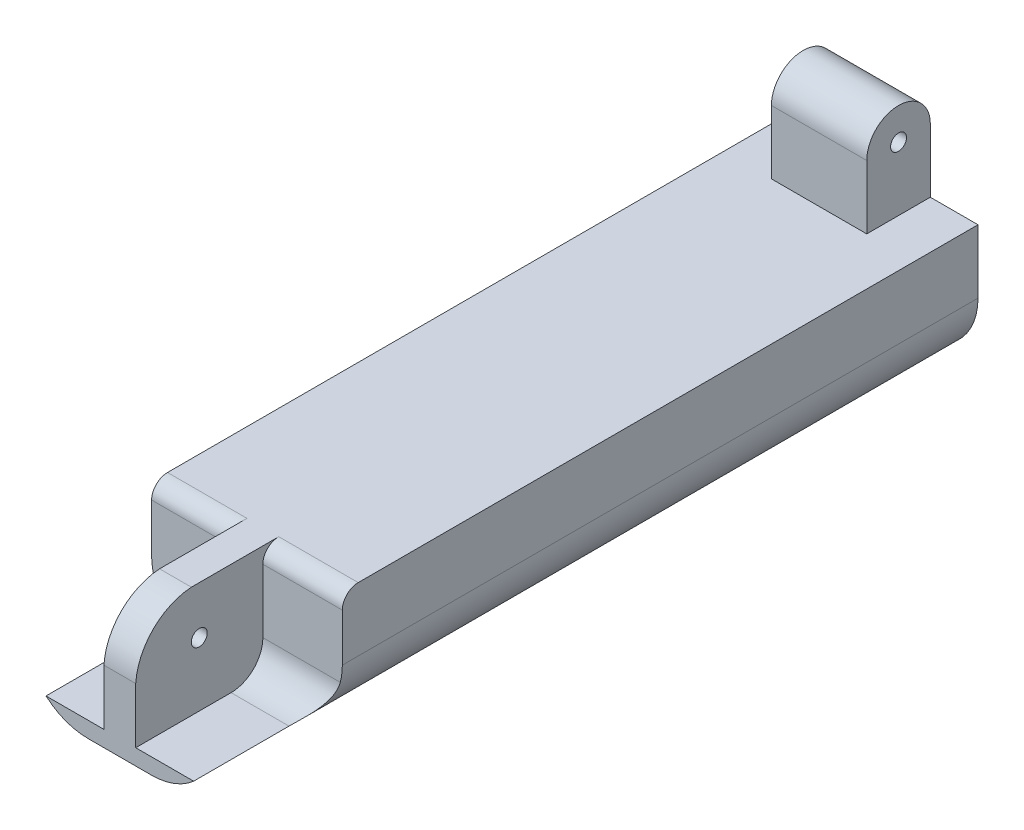
from build123d import *

# Parameters (mm, degrees)
SKETCH1_W           = 60
SKETCH1_H           = 40
BOSS_EXTRUDE1_DEPTH = 240
SKETCH2_W           = 25
SKETCH2_H           = 40
CUT_EXTRUDE1_DEPTH  = 35
BOSS_EXTRUDE7_DEPTH = 25
BOSS_EXTRUDE5_START = 25
BOSS_EXTRUDE5_DEPTH = 25
SKETCH3_W           = 30
SKETCH3_H           = 20
BOSS_EXTRUDE2_DEPTH = 35
SKETCH5_R           = 2.5
CUT_EXTRUDE3_DEPTH  = 30
CUT_EXTRUDE4_DEPTH  = 240
CUT_EXTRUDE5_DEPTH  = 20
CUT_EXTRUDE6_DEPTH  = 25
CUT_EXTRUDE7_START  = -25
CUT_EXTRUDE7_DEPTH  = 25
SKETCH19_R          = 2.5
CUT_EXTRUDE8_DEPTH  = 30
CUT_EXTRUDE9_DEPTH  = 30


with BuildPart() as part:
    # Sketch1 → Boss-Extrude1 (new body)
    with BuildSketch(Plane.XY):
        with Locations((-30, 20)):
            Rectangle(SKETCH1_W, SKETCH1_H)
    extrude(amount=BOSS_EXTRUDE1_DEPTH)

    # Sketch2 → Cut-Extrude1 (cut)
    with BuildSketch(Plane(origin=(0, 40, 0), x_dir=(1, 0, 0), z_dir=(0, 1, 0))):
        with Locations((-47.5, -220)):
            Rectangle(SKETCH2_W, SKETCH2_H)
        with Locations((-12.5, -220)):
            Rectangle(SKETCH2_W, SKETCH2_H)
    extrude(amount=-CUT_EXTRUDE1_DEPTH, mode=Mode.SUBTRACT)

    # Sketch18 → Boss-Extrude7 (add)
    with BuildSketch(Plane(origin=(-25, 0, 0), x_dir=(0, 0, -1), z_dir=(1, 0, 0))):
        with BuildLine():
            Line((-200, 5), (-210, 5))
            ThreePointArc((-210, 5), (-202.928932188, 7.928932188), (-200, 15))
            Line((-200, 15), (-200, 5))
        make_face()
    extrude(amount=BOSS_EXTRUDE7_DEPTH)

    # Sketch16 → Boss-Extrude5 (add)
    with BuildSketch(Plane.ZY.offset(35).offset(BOSS_EXTRUDE5_START)):
        with BuildLine():
            Line((200, 15), (160, 5))
            Line((160, 5), (210, 5))
            ThreePointArc((210, 5), (202.928932188, 7.928932188), (200, 15))
        make_face()
    extrude(amount=-BOSS_EXTRUDE5_DEPTH)

    # Sketch3 → Boss-Extrude2 (add)
    with BuildSketch(Plane(origin=(0, 40, 0), x_dir=(1, 0, 0), z_dir=(0, 1, 0))):
        with Locations((-30, -10)):
            Rectangle(SKETCH3_W, SKETCH3_H)
    extrude(amount=BOSS_EXTRUDE2_DEPTH)

    # Sketch5 → Cut-Extrude3 (cut)
    with BuildSketch(Plane(origin=(-25, 0, 0), x_dir=(0, 0, -1), z_dir=(1, 0, 0))):
        with Locations((-220, 25)):
            Circle(SKETCH5_R)
    extrude(amount=-CUT_EXTRUDE3_DEPTH, mode=Mode.SUBTRACT)

    # Sketch6 → Cut-Extrude4 (cut)
    with BuildSketch(Plane(origin=(0, 0, 0), x_dir=(-1, 0, 0), z_dir=(0, 0, -1))):
        with BuildLine():
            Line((60, 20), (60, 0))
            Line((60, 0), (40, 0))
            ThreePointArc((40, 0), (54.142135624, 5.857864376), (60, 20))
        make_face()
        with BuildLine():
            Line((0, 20), (0, 0))
            Line((0, 0), (20, 0))
            ThreePointArc((20, 0), (5.857864376, 5.857864376), (0, 20))
        make_face()
    extrude(amount=-CUT_EXTRUDE4_DEPTH, mode=Mode.SUBTRACT)

    # Sketch8 → Cut-Extrude5 (cut)
    with BuildSketch(Plane(origin=(-25, 0, 0), x_dir=(0, 0, -1), z_dir=(1, 0, 0))):
        with BuildLine():
            Line((-240, 40), (-240, 22.5))
            ThreePointArc((-240, 22.5), (-234.537682266, 34.537682266), (-222.5, 40))
            Line((-222.5, 40), (-240, 40))
        make_face()
    extrude(amount=-CUT_EXTRUDE5_DEPTH, mode=Mode.SUBTRACT)

    # Sketch10 → Cut-Extrude6 (cut)
    with BuildSketch(Plane(origin=(0, 0, 0), x_dir=(0, 0, -1), z_dir=(1, 0, 0))):
        with BuildLine():
            Line((-200, 40), (-195, 40))
            ThreePointArc((-195, 40), (-198.535533906, 38.535533906), (-200, 35))
            Line((-200, 35), (-200, 40))
        make_face()
    extrude(amount=-CUT_EXTRUDE6_DEPTH, mode=Mode.SUBTRACT)

    # Sketch11 → Cut-Extrude7 (cut)
    with BuildSketch(Plane.ZY.offset(60).offset(CUT_EXTRUDE7_START)):
        with BuildLine():
            Line((200, 40), (195, 40))
            ThreePointArc((195, 40), (198.535533906, 38.535533906), (200, 35))
            Line((200, 35), (200, 40))
        make_face()
    extrude(amount=CUT_EXTRUDE7_DEPTH, mode=Mode.SUBTRACT)

    # Sketch19 → Cut-Extrude8 (cut)
    with BuildSketch(Plane(origin=(-15, 0, 0), x_dir=(0, 0, -1), z_dir=(1, 0, 0))):
        with Locations((-10, 60)):
            Circle(SKETCH19_R)
    extrude(amount=-CUT_EXTRUDE8_DEPTH, mode=Mode.SUBTRACT)

    # Sketch20 → Cut-Extrude9 (cut)
    with BuildSketch(Plane(origin=(-15, 0, 0), x_dir=(0, 0, -1), z_dir=(1, 0, 0))):
        with BuildLine():
            Line((-20, 75), (0, 75))
            Line((0, 75), (0, 60))
            ThreePointArc((0, 60), (-10, 70), (-20, 60))
            Line((-20, 60), (-20, 75))
        make_face()
    extrude(amount=-CUT_EXTRUDE9_DEPTH, mode=Mode.SUBTRACT)


solid = part.part
